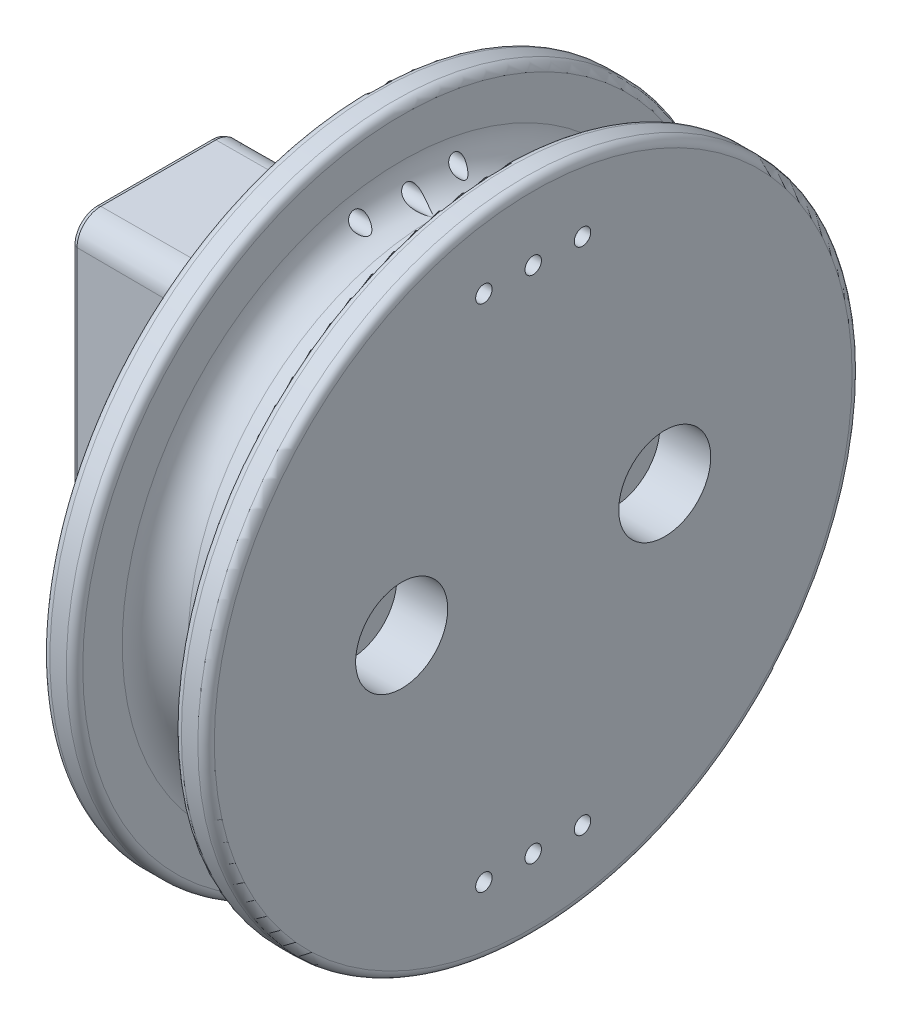
from build123d import *
from OCP.BRepFilletAPI import BRepFilletAPI_MakeChamfer

# Parameters (mm, degrees)
SKIZZE1_R                                            = 11.5
AUFSATZ_LINEAR_AUSTRAGEN1_DEPTH                      = 13
AUFSATZ_LINEAR_AUSTRAGEN2_DEPTH                      = 10
AUFSATZ_LINEAR_AUSTRAGEN2_DRAFT                      = -0.3
STIRNSENKUNG_F_R_M3_ZYLINDERSCHRAUBE_MIT_D           = 3.1
STIRNSENKUNG_F_R_M3_ZYLINDERSCHRAUBE_MIT_CBORE_D     = 5.6
STIRNSENKUNG_F_R_M3_ZYLINDERSCHRAUBE_MIT_CBORE_DEPTH = 3.1
SKIZZE6_R                                            = 19.9
SKIZZE6_R_2                                          = 11.5
AUFSATZ_LINEAR_AUSTRAGEN3_DEPTH                      = 10
VERRUNDUNG1_R                                        = 1
FASE2_SIZE                                           = 0.2
FASE2_SIZE2                                          = 0.07293404
SKIZZE8_W                                            = 6
SKIZZE8_H                                            = 4.9
VERRUNDUNG2_R                                        = 2
VERRUNDUNG3_R                                        = 0.5
VERRUNDUNG4_R                                        = 2
SCHNITT_LINEAR_START                                 = -10
SKIZZE10_R                                           = 0.5
SCHNITT_LINEAR_AUSTRAGEN4_DEPTH                      = 44.406885637


with BuildPart() as part:
    # Skizze1 → Aufsatz-Linear austragen1 (new body)
    with BuildSketch(Plane(origin=(0, 0, 0), x_dir=(0, 0, -1), z_dir=(1, 0, 0))):
        with Locations(Location((0, 0, 0), (0, 0, 180))):
            Circle(SKIZZE1_R)
    extrude(amount=AUFSATZ_LINEAR_AUSTRAGEN1_DEPTH)


with BuildPart() as aufsatz_linear_austragen2_tool:
    # Skizze2 → Aufsatz-Linear austragen2 (with draft: the straight prism first)
    with BuildSketch(Plane(origin=(0, 0, 0), x_dir=(0, 0, -1), z_dir=(1, 0, 0))):
        with BuildLine():
            Line((5, -7.5), (5, 7.5))
            ThreePointArc((5, 7.5), (4.560660172, 8.560660172), (3.5, 9))
            Line((3.5, 9), (-3.5, 9))
            ThreePointArc((-3.5, 9), (-4.560660172, 8.560660172), (-5, 7.5))
            Line((-5, 7.5), (-5, -7.5))
            ThreePointArc((-5, -7.5), (-4.560660172, -8.560660172), (-3.5, -9))
            Line((-3.5, -9), (3.5, -9))
            ThreePointArc((3.5, -9), (4.560660172, -8.560660172), (5, -7.5))
        make_face()
    extrude(amount=-AUFSATZ_LINEAR_AUSTRAGEN2_DEPTH)
    # Aufsatz-Linear austragen2: the draft: its side faces are tilted about the plane it starts from
    aufsatz_linear_austragen2_sides = [aufsatz_linear_austragen2_tool.faces().sort_by_distance(p)[0] for p in [
        (-5, 0, -5),
        (-5, 8.560660172, -4.560660172),
        (-5, 9, 0),
        (-5, 8.560660172, 4.560660172),
        (-5, 0, 5),
        (-5, -8.560660172, 4.560660172),
        (-5, -9, 0),
        (-5, -8.560660172, -4.560660172),
    ]]
    draft(aufsatz_linear_austragen2_sides, Plane(origin=(0, 0, 0), x_dir=(0, 0, -1), z_dir=(1, 0, 0)), AUFSATZ_LINEAR_AUSTRAGEN2_DRAFT)


with BuildPart() as part_1:
    add(part.part)

    # Aufsatz-Linear austragen2: add aufsatz_linear_austragen2_tool
    add(aufsatz_linear_austragen2_tool.part)

    # Stirnsenkung für M3 Zylinderschraube mit Innensechskant1 (through all)
    with Locations(Plane(origin=(13, 0, 0), x_dir=(0, 0, -1), z_dir=(1, 0, 0))):
        with Locations((8, 0), (-8, 0)):
            CounterBoreHole(STIRNSENKUNG_F_R_M3_ZYLINDERSCHRAUBE_MIT_D / 2, STIRNSENKUNG_F_R_M3_ZYLINDERSCHRAUBE_MIT_CBORE_D / 2, STIRNSENKUNG_F_R_M3_ZYLINDERSCHRAUBE_MIT_CBORE_DEPTH)

    # Skizze6 → Aufsatz-Linear austragen3 (add)
    with BuildSketch(Plane(origin=(3, 0, 0), x_dir=(0, 0, -1), z_dir=(1, 0, 0))):
        Circle(SKIZZE6_R)
        with Locations(Location((0, 0, 0), (0, 0, 180))):
            Circle(SKIZZE6_R_2, mode=Mode.SUBTRACT)
    extrude(amount=AUFSATZ_LINEAR_AUSTRAGEN3_DEPTH)

    # Verrundung1
    verrundung1_edges = [part_1.edges().sort_by_distance(p)[0] for p in [
        (0, -8.560660172, 4.560660172),
        (0, -9, 0),
        (0, -8.560660172, -4.560660172),
        (0, 0, -5),
        (0, 8.560660172, -4.560660172),
        (0, 9, 0),
        (0, 8.560660172, 4.560660172),
        (0, 0, 5),
    ]]
    fillet(verrundung1_edges, radius=VERRUNDUNG1_R)

    # Fase2: one chamfer whose edges measure the first distance from different faces: ONE call of the kernel's chamfer builder (chamfer() names one face for all edges)
    fase2_edges_1 = [part_1.edges().sort_by_distance(p)[0] for p in [
        (-10, 8.947639644, 0),
    ]]
    fase2_side_1 = [part_1.faces().sort_by_distance(p)[0] for p in [
        (-5.497382018, 8.971215512, 0),
    ]]
    fase2_edges_2 = [part_1.edges().sort_by_distance(p)[0] for p in [
        (-10, 8.523635809, -4.523635809),
    ]]
    fase2_side_2 = [part_1.faces().sort_by_distance(p)[0] for p in [
        (-5.497382018, 8.540306465, -4.540306465),
    ]]
    fase2_edges_3 = [part_1.edges().sort_by_distance(p)[0] for p in [
        (-10, 0, -4.947639644),
    ]]
    fase2_side_3 = [part_1.faces().sort_by_distance(p)[0] for p in [
        (-5.497382018, 0, -4.971215512),
    ]]
    fase2_edges_4 = [part_1.edges().sort_by_distance(p)[0] for p in [
        (-10, -8.523635809, -4.523635809),
    ]]
    fase2_side_4 = [part_1.faces().sort_by_distance(p)[0] for p in [
        (-5.497382018, -8.540306465, -4.540306465),
    ]]
    fase2_edges_5 = [part_1.edges().sort_by_distance(p)[0] for p in [
        (-10, -8.947639644, 0),
    ]]
    fase2_side_5 = [part_1.faces().sort_by_distance(p)[0] for p in [
        (-5.497382018, -8.971215512, 0),
    ]]
    fase2_edges_6 = [part_1.edges().sort_by_distance(p)[0] for p in [
        (-10, -8.523635809, 4.523635809),
    ]]
    fase2_side_6 = [part_1.faces().sort_by_distance(p)[0] for p in [
        (-5.497382018, -8.540306465, 4.540306465),
    ]]
    fase2_edges_7 = [part_1.edges().sort_by_distance(p)[0] for p in [
        (-10, 0, 4.947639644),
    ]]
    fase2_side_7 = [part_1.faces().sort_by_distance(p)[0] for p in [
        (-5.497382018, 0, 4.971215512),
    ]]
    fase2_edges_8 = [part_1.edges().sort_by_distance(p)[0] for p in [
        (-10, 8.523635809, 4.523635809),
    ]]
    fase2_side_8 = [part_1.faces().sort_by_distance(p)[0] for p in [
        (-5.497382018, 8.540306465, 4.540306465),
    ]]
    fase2 = BRepFilletAPI_MakeChamfer(part_1.part.solid().wrapped)
    for e in fase2_edges_1:
        fase2.Add(FASE2_SIZE, FASE2_SIZE2, e.wrapped, fase2_side_1[0].wrapped)  # the first distance lies on this face
    for e in fase2_edges_2:
        fase2.Add(FASE2_SIZE, FASE2_SIZE2, e.wrapped, fase2_side_2[0].wrapped)  # the first distance lies on this face
    for e in fase2_edges_3:
        fase2.Add(FASE2_SIZE, FASE2_SIZE2, e.wrapped, fase2_side_3[0].wrapped)  # the first distance lies on this face
    for e in fase2_edges_4:
        fase2.Add(FASE2_SIZE, FASE2_SIZE2, e.wrapped, fase2_side_4[0].wrapped)  # the first distance lies on this face
    for e in fase2_edges_5:
        fase2.Add(FASE2_SIZE, FASE2_SIZE2, e.wrapped, fase2_side_5[0].wrapped)  # the first distance lies on this face
    for e in fase2_edges_6:
        fase2.Add(FASE2_SIZE, FASE2_SIZE2, e.wrapped, fase2_side_6[0].wrapped)  # the first distance lies on this face
    for e in fase2_edges_7:
        fase2.Add(FASE2_SIZE, FASE2_SIZE2, e.wrapped, fase2_side_7[0].wrapped)  # the first distance lies on this face
    for e in fase2_edges_8:
        fase2.Add(FASE2_SIZE, FASE2_SIZE2, e.wrapped, fase2_side_8[0].wrapped)  # the first distance lies on this face
    add(Compound.cast(fase2.Shape()), mode=Mode.REPLACE)

    # Skizze8 → Schnitt-Rotation1 (revolve, cut)
    with BuildSketch(Plane(origin=(0, 0, 0), x_dir=(1, 0, 0), z_dir=(0, 1, 0)), mode=Mode.PRIVATE) as schnitt_rotation1_sk:
        with Locations((8, -17.45)):
            Rectangle(SKIZZE8_W, SKIZZE8_H)
    revolve(schnitt_rotation1_sk.sketch.rotate(Axis((11, 0, 0), (-1, 0, 0)), 180), axis=Axis((11, 0, 0), (-1, 0, 0)), mode=Mode.SUBTRACT)

    # Verrundung2
    verrundung2_edges = [part_1.edges().sort_by_distance(p)[0] for p in [
        (11, 0, 15),
        (5, 0, 15),
    ]]
    fillet(verrundung2_edges, radius=VERRUNDUNG2_R)

    # Verrundung3
    verrundung3_edges = [part_1.edges().sort_by_distance(p)[0] for p in [
        (5, 0, 19.9),
        (11, 0, 19.9),
        (13, 0, 19.9),
        (3, 0, 19.9),
    ]]
    fillet(verrundung3_edges, radius=VERRUNDUNG3_R)

    # Verrundung4
    verrundung4_edges = [part_1.edges().sort_by_distance(p)[0] for p in [
        (3, 0, -11.5),
    ]]
    fillet(verrundung4_edges, radius=VERRUNDUNG4_R)

    # Skizze10 → Schnitt-Linear austragen4 (cut)
    with BuildSketch(Plane(origin=(8, 0, 0), x_dir=(0, 0, -1), z_dir=(1, 0, 0)).offset(SCHNITT_LINEAR_START)):
        with Locations((3, -15.5)):
            Circle(SKIZZE10_R)
        with Locations((-3, -15.5)):
            Circle(SKIZZE10_R)
        with Locations((0, -15.5)):
            Circle(SKIZZE10_R)
    schnitt_linear_austragen4 = extrude(amount=SCHNITT_LINEAR_AUSTRAGEN4_DEPTH, mode=Mode.SUBTRACT)

    # Spiegeln1: Schnitt-Linear austragen4 across plane
    add(schnitt_linear_austragen4.mirror(Plane.ZX), mode=Mode.SUBTRACT)


solid = part_1.part
